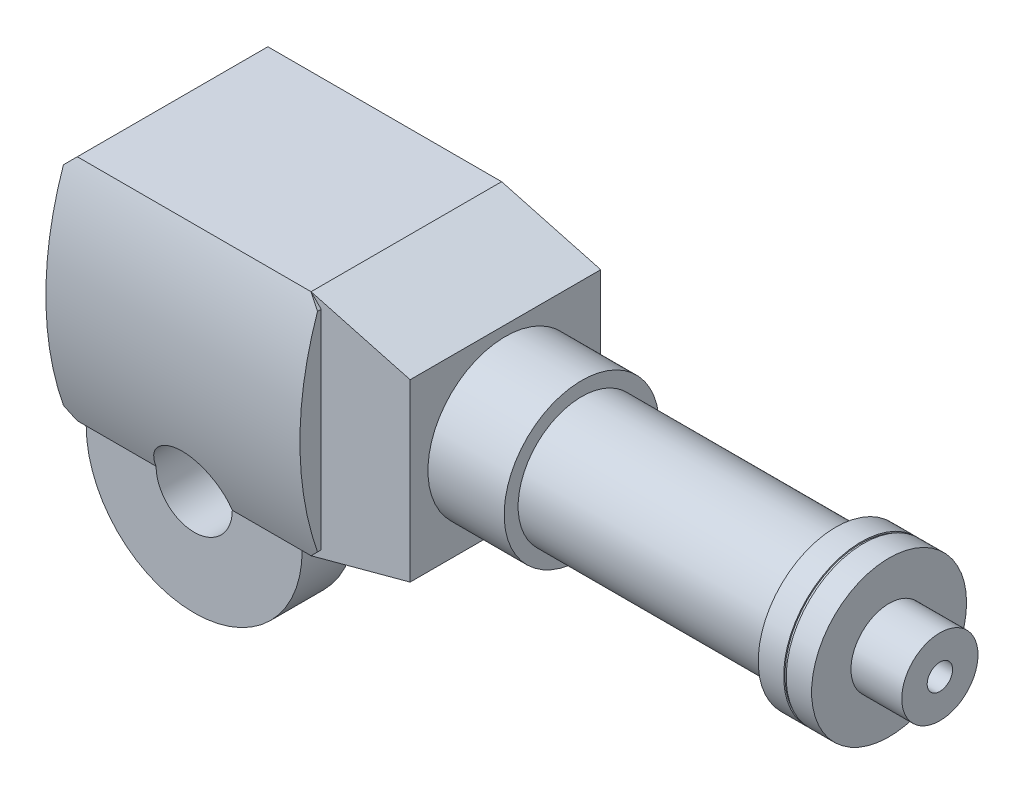
from build123d import *

# Parameters (mm, degrees)
SKETCH2_W               = 50
SKETCH2_H               = 45
BOSS_EXTRUDE1_DEPTH     = 37.5
BOSS_EXTRUDE2_DEPTH     = 50
CHAMFER2_SIZE           = 2
BOSS_EXTRUDE3_DEPTH     = 10.5
BOSS_EXTRUDE4_DEPTH     = 25
CUT_EXTRUDE2_DEPTH      = 65.143563871
CUT_EXTRUDE2_DEPTH_BACK = 65.143563871
SKETCH10_R              = 2.5
BOSS_EXTRUDE6_DEPTH     = 37.5
SKETCH15_R              = 15.25
BOSS_EXTRUDE8_DEPTH     = 15
SKETCH16_R              = 12.5
BOSS_EXTRUDE9_DEPTH     = 50
SKETCH17_R              = 15.25
BOSS_EXTRUDE10_DEPTH    = 5
SKETCH18_R              = 15
BOSS_EXTRUDE11_DEPTH    = 0.5
SKETCH19_R              = 15.25
BOSS_EXTRUDE12_DEPTH    = 5
SKETCH20_R              = 7.5
SKETCH20_R_2            = 2.5
BOSS_EXTRUDE13_DEPTH    = 10
CUT_EXTRUDE3_DEPTH      = 142.549138883
CUT_EXTRUDE3_DEPTH_BACK = 10
SKETCH21_R              = 7.5


with BuildPart() as part:
    # Sketch2 → Boss-Extrude1 (new body)
    with BuildSketch(Plane.XY):
        Rectangle(SKETCH2_W, SKETCH2_H)
    extrude(amount=-BOSS_EXTRUDE1_DEPTH)

    # Sketch3 → Boss-Extrude2 (add, through all)
    with BuildSketch(Plane(origin=(25, 0, 0), x_dir=(0, 0, -1), z_dir=(1, 0, 0))):
        with BuildLine():
            Line((0, 22.5), (0, -22.5))
            ThreePointArc((0, -22.5), (-4.190481052, 0), (0, 22.5))
        make_face()
        with BuildLine():
            Line((37.5, 22.5), (37.5, -22.5))
            ThreePointArc((37.5, -22.5), (41.690481052, 0), (37.5, 22.5))
        make_face()
    extrude(amount=-BOSS_EXTRUDE2_DEPTH)

    # Chamfer2
    chamfer2_edges = [part.edges().sort_by_distance(p)[0] for p in [
        (25, -22.5, -18.75),
        (-25, -22.5, -18.75),
        (-25, 22.5, -18.75),
        (25, 22.5, -18.75),
    ]]
    chamfer(chamfer2_edges, length=CHAMFER2_SIZE)

    # Sketch7 → Boss-Extrude3 (add)
    with BuildSketch(Plane.XY):
        with BuildLine():
            Line((-21.25, -22.5), (21.25, -22.5))
            ThreePointArc((21.25, -22.5), (0, -43.75), (-21.25, -22.5))
        make_face()
    extrude(amount=-BOSS_EXTRUDE3_DEPTH)

    # Sketch8 → Boss-Extrude4 (add)
    with BuildSketch(Plane(origin=(0, 0, -10.5), x_dir=(-1, 0, 0), z_dir=(0, 0, -1))):
        with BuildLine():
            Line((-10, -22.5), (10, -22.5))
            Line((10, -22.5), (10, -37.5))
            ThreePointArc((10, -37.5), (0, -40.527756377), (-10, -37.5))
            Line((-10, -37.5), (-10, -22.5))
        make_face()
    extrude(amount=BOSS_EXTRUDE4_DEPTH)

    # Sketch10 → Cut-Extrude2 (cut, two sides: drawn at the far end of the back side and taken through both)
    with BuildSketch(Plane(origin=(0, 0, -35.5), x_dir=(-1, 0, 0), z_dir=(0, 0, -1)).offset(-CUT_EXTRUDE2_DEPTH_BACK)):
        with Locations((0, -22.5)):
            Circle(SKETCH10_R)
    extrude(amount=CUT_EXTRUDE2_DEPTH + CUT_EXTRUDE2_DEPTH_BACK, mode=Mode.SUBTRACT)

    # Sketch13 → Boss-Extrude6 (add)
    with BuildSketch(Plane.XY):
        Polygon((23, 22.5), (23, -22.5), (42.5, -17.25), (42.5, 0), (42.5, 17.25), align=None)
    extrude(amount=-BOSS_EXTRUDE6_DEPTH)

    # Sketch15 → Boss-Extrude8 (add)
    with BuildSketch(Plane(origin=(42.5, 0, 0), x_dir=(0, 0, -1), z_dir=(1, 0, 0))):
        with Locations((18.75, 0)):
            Circle(SKETCH15_R)
    extrude(amount=BOSS_EXTRUDE8_DEPTH)

    # Sketch16 → Boss-Extrude9 (add)
    with BuildSketch(Plane(origin=(57.5, 0, 0), x_dir=(0, 0, -1), z_dir=(1, 0, 0))):
        with Locations((18.75, 0)):
            Circle(SKETCH16_R)
    extrude(amount=BOSS_EXTRUDE9_DEPTH)

    # Sketch17 → Boss-Extrude10 (add)
    with BuildSketch(Plane(origin=(107.5, 0, 0), x_dir=(0, 0, -1), z_dir=(1, 0, 0))):
        with Locations((18.75, 0)):
            Circle(SKETCH17_R)
    extrude(amount=BOSS_EXTRUDE10_DEPTH)

    # Sketch18 → Boss-Extrude11 (add)
    with BuildSketch(Plane(origin=(112.5, 0, 0), x_dir=(0, 0, -1), z_dir=(1, 0, 0))):
        with Locations((18.75, 0)):
            Circle(SKETCH18_R)
    extrude(amount=BOSS_EXTRUDE11_DEPTH)

    # Sketch19 → Boss-Extrude12 (add)
    with BuildSketch(Plane(origin=(113, 0, 0), x_dir=(0, 0, -1), z_dir=(1, 0, 0))):
        with Locations((18.75, 0)):
            Circle(SKETCH19_R)
    extrude(amount=BOSS_EXTRUDE12_DEPTH)

    # Sketch20 → Boss-Extrude13 (add)
    with BuildSketch(Plane(origin=(118, 0, 0), x_dir=(0, 0, -1), z_dir=(1, 0, 0))):
        with Locations((18.75, 0)):
            Circle(SKETCH20_R)
        with Locations((18.75, 0)):
            Circle(SKETCH20_R_2, mode=Mode.SUBTRACT)
    extrude(amount=BOSS_EXTRUDE13_DEPTH)

    # Sketch21 → Cut-Extrude3 (cut, two sides: drawn at the far end of the back side and taken through both)
    with BuildSketch(Plane.XY.offset(-CUT_EXTRUDE3_DEPTH_BACK)):
        with Locations((0, -22.5)):
            Circle(SKETCH21_R)
    extrude(amount=CUT_EXTRUDE3_DEPTH + CUT_EXTRUDE3_DEPTH_BACK, mode=Mode.SUBTRACT)


solid = part.part
